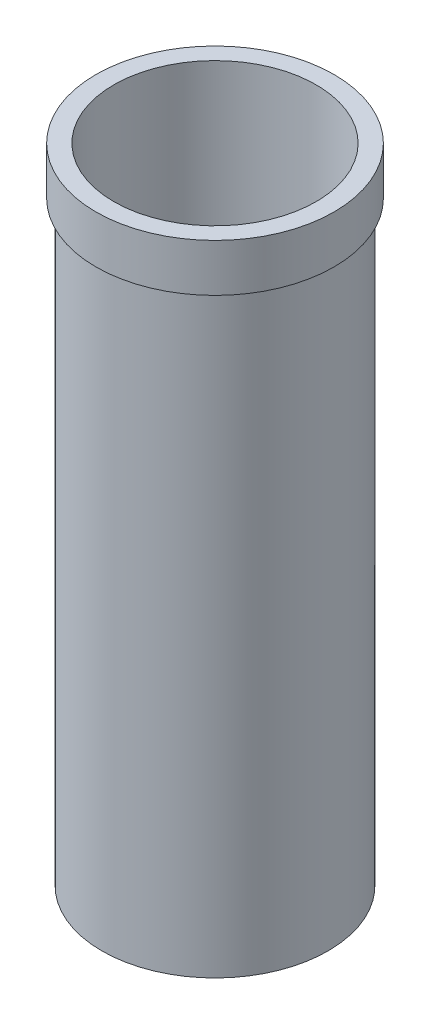
from build123d import *

# Parameters (mm, degrees)
SKETCH2_R           = 4.75
SKETCH2_R_2         = 4.25
BOSS_EXTRUDE1_DEPTH = 25
SKETCH3_R           = 5
SKETCH3_R_2         = 4.25
BOSS_EXTRUDE2_DEPTH = 2


with BuildPart() as part:
    # Sketch2 → Boss-Extrude1 (new body)
    with BuildSketch(Plane(origin=(0, 0, 0), x_dir=(1, 0, 0), z_dir=(0, 1, 0))):
        with Locations(Location((0, 0, 0), (0, 0, 270))):
            Circle(SKETCH2_R)
        with Locations(Location((0, 0, 0), (0, 0, 270))):
            Circle(SKETCH2_R_2, mode=Mode.SUBTRACT)
    extrude(amount=BOSS_EXTRUDE1_DEPTH)

    # Sketch3 → Boss-Extrude2 (add)
    with BuildSketch(Plane(origin=(0, 25, 0), x_dir=(1, 0, 0), z_dir=(0, 1, 0))):
        with Locations(Location((0, 0, 0), (0, 0, 270))):
            Circle(SKETCH3_R)
        with Locations(Location((0, 0, 0), (0, 0, 270))):
            Circle(SKETCH3_R_2, mode=Mode.SUBTRACT)
    extrude(amount=BOSS_EXTRUDE2_DEPTH)


solid = part.part
